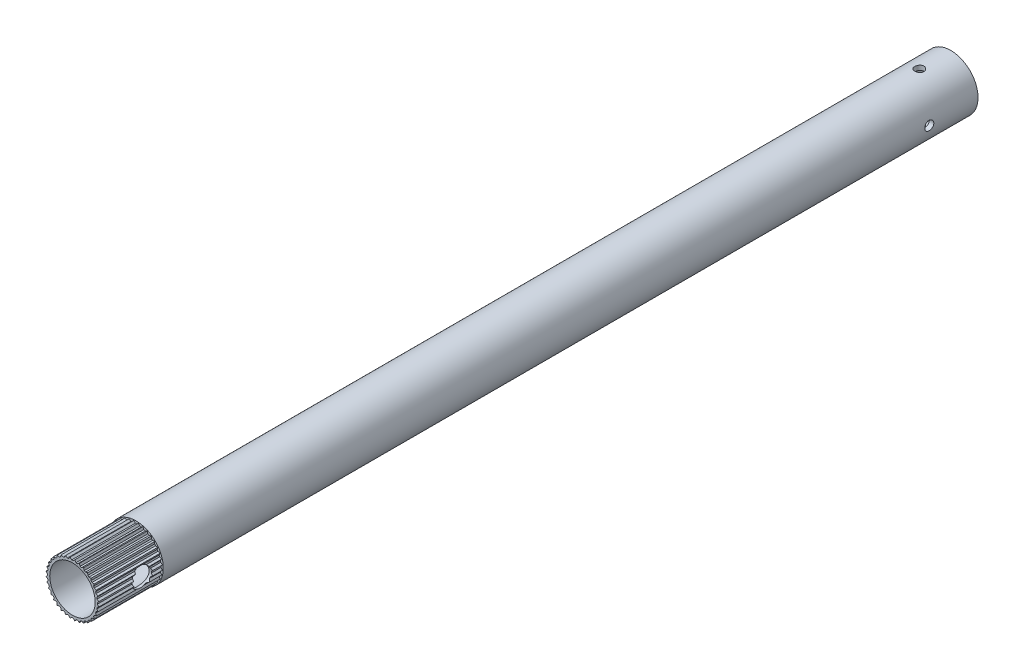
from build123d import *

# Parameters (mm, degrees)
SKETCH5_W               = 1.587499994
SKETCH5_H               = 306.916283212
CUT_EXTRUDE5_DEPTH      = 330.351514993
CUT_EXTRUDE5_DEPTH_BACK = 330.351514993
SKETCH7_R               = 1.5875
SKETCH7_R_2             = 3.3782
CUT_EXTRUDE6_DEPTH      = 330.351515099
CUT_EXTRUDE6_DEPTH_BACK = 330.351515099
SKETCH6_R               = 1.5875
CUT_EXTRUDE7_START      = 329.075932
SKETCH8_R               = 12.7
CUT_EXTRUDE7_DEPTH      = 22.225


with BuildPart() as part:
    # Sketch5 → Revolve2 (revolve)
    with BuildSketch(Plane(origin=(0, 0, 0), x_dir=(1, 0, 0), z_dir=(0, 1, 0)), mode=Mode.PRIVATE) as revolve2_sk:
        with Locations((8.731249997, -175.617790632)):
            Rectangle(SKETCH5_W, SKETCH5_H)
    revolve(revolve2_sk.sketch.rotate(Axis((0, 0, -2.015669047), (0, 0, 1)), 180), axis=Axis((0, 0, -2.015669047), (0, 0, 1)))

    # Sketch7 → Cut-Extrude5 (cut, two sides: drawn at the far end of the back side and taken through both)
    with BuildSketch(Plane(origin=(0, 0, 0), x_dir=(0, 0, -1), z_dir=(1, 0, 0)).offset(-CUT_EXTRUDE5_DEPTH_BACK)):
        with Locations((-39.195999993, 0)):
            Circle(SKETCH7_R)
        with Locations((-313.582332238, 0)):
            Circle(SKETCH7_R_2)
    extrude(amount=CUT_EXTRUDE5_DEPTH + CUT_EXTRUDE5_DEPTH_BACK, mode=Mode.SUBTRACT)

    # Sketch6 → Cut-Extrude6 (cut, two sides: drawn at the far end of the back side and taken through both)
    with BuildSketch(Plane(origin=(0, 0, 0), x_dir=(1, 0, 0), z_dir=(0, 1, 0)).offset(-CUT_EXTRUDE6_DEPTH_BACK)):
        with Locations(Location((1e-09, -33.163499999, 0), (0, 0, 269.999999955))):
            Circle(SKETCH6_R)
    extrude(amount=CUT_EXTRUDE6_DEPTH + CUT_EXTRUDE6_DEPTH_BACK, mode=Mode.SUBTRACT)

    # Sketch8 → Cut-Extrude7 (cut)
    with BuildSketch(Plane.XY.offset(CUT_EXTRUDE7_START)):
        Circle(SKETCH8_R)
        Polygon((9.235721046, -0.808020891), (8.681700155, -0.254), (8.681700155, 0.254), (9.235721046, 0.808020891), (8.593912259, 1.257420242), (8.505698985, 1.75770258), (8.955098336, 2.399511367), (8.245002688, 2.730634406), (8.071256455, 3.207998257), (8.402379494, 3.918093905), (7.645572882, 4.120879625), (7.391572882, 4.56082053), (7.594358603, 5.317627141), (6.813836213, 5.385914002), (6.487300108, 5.775064579), (6.555586968, 6.555586968), (5.775064579, 6.487300108), (5.385914002, 6.813836213), (5.317627141, 7.594358603), (4.56082053, 7.391572882), (4.120879625, 7.645572882), (3.918093905, 8.402379494), (3.207998257, 8.071256455), (2.730634406, 8.245002688), (2.399511367, 8.955098336), (1.75770258, 8.505698985), (1.257420242, 8.593912259), (0.808020891, 9.235721046), (0.254, 8.681700155), (-0.254, 8.681700155), (-0.808020891, 9.235721046), (-1.257420242, 8.593912259), (-1.75770258, 8.505698985), (-2.399511367, 8.955098336), (-2.730634406, 8.245002688), (-3.207998257, 8.071256455), (-3.918093905, 8.402379494), (-4.120879625, 7.645572882), (-4.56082053, 7.391572882), (-5.317627141, 7.594358603), (-5.385914002, 6.813836213), (-5.775064579, 6.487300108), (-6.555586968, 6.555586968), (-6.487300108, 5.775064579), (-6.813836213, 5.385914002), (-7.594358603, 5.317627141), (-7.391572882, 4.56082053), (-7.645572882, 4.120879625), (-8.402379494, 3.918093905), (-8.071256455, 3.207998257), (-8.245002688, 2.730634406), (-8.955098336, 2.399511367), (-8.505698985, 1.75770258), (-8.593912259, 1.257420242), (-9.235721046, 0.808020891), (-8.681700155, 0.254), (-8.681700155, -0.254), (-9.235721046, -0.808020891), (-8.593912259, -1.257420242), (-8.505698985, -1.75770258), (-8.955098336, -2.399511367), (-8.245002688, -2.730634406), (-8.071256455, -3.207998257), (-8.402379494, -3.918093905), (-7.645572882, -4.120879625), (-7.391572882, -4.56082053), (-7.594358603, -5.317627141), (-6.813836213, -5.385914002), (-6.487300108, -5.775064579), (-6.555586968, -6.555586968), (-5.775064579, -6.487300108), (-5.385914002, -6.813836213), (-5.317627141, -7.594358603), (-4.56082053, -7.391572882), (-4.120879625, -7.645572882), (-3.918093905, -8.402379494), (-3.207998257, -8.071256455), (-2.730634406, -8.245002688), (-2.399511367, -8.955098336), (-1.75770258, -8.505698985), (-1.257420242, -8.593912259), (-0.808020891, -9.235721046), (-0.254, -8.681700155), (0.254, -8.681700155), (0.808020891, -9.235721046), (1.257420242, -8.593912259), (1.75770258, -8.505698985), (2.399511367, -8.955098336), (2.730634406, -8.245002688), (3.207998257, -8.071256455), (3.918093905, -8.402379494), (4.120879625, -7.645572882), (4.56082053, -7.391572882), (5.317627141, -7.594358603), (5.385914002, -6.813836213), (5.775064579, -6.487300108), (6.555586968, -6.555586968), (6.487300108, -5.775064579), (6.813836213, -5.385914002), (7.594358603, -5.317627141), (7.391572882, -4.56082053), (7.645572882, -4.120879625), (8.402379494, -3.918093905), (8.071256455, -3.207998257), (8.245002688, -2.730634406), (8.955098336, -2.399511367), (8.505698985, -1.75770258), (8.593912259, -1.257420242), align=None, mode=Mode.SUBTRACT)
    extrude(amount=-CUT_EXTRUDE7_DEPTH, mode=Mode.SUBTRACT)


solid = part.part
